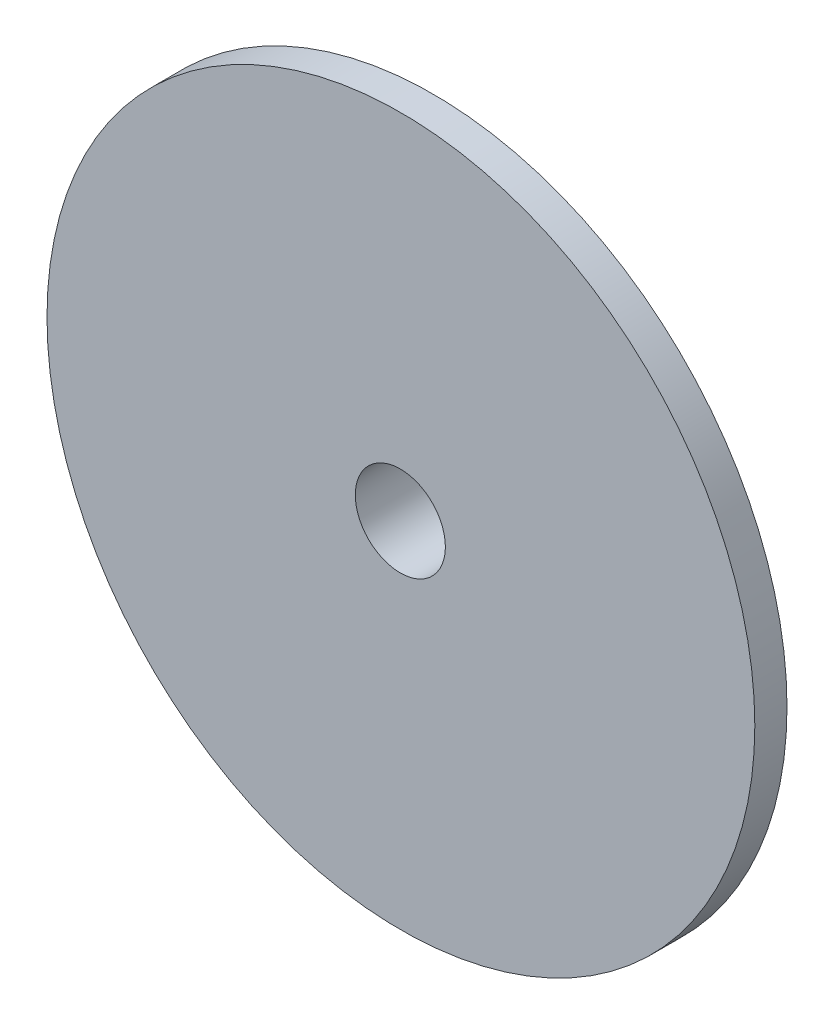
from build123d import *

# Parameters (mm, degrees)
SKETCH1_R             = 4
BOSS_EXTRUDE1_DEPTH   = 10
BOSS_EXTRUDE1_2_DEPTH = 10
SKETCH1_3_R           = 55
BOSS_EXTRUDE2_DEPTH   = 5
SKETCH2_R             = 7
CUT_EXTRUDE1_DEPTH    = 80.277412294


with BuildPart() as part:
    # Sketch1 → Boss-Extrude1 (new body)
    with BuildSketch(Plane.XY):
        with Locations((-46.163581641, 19.207370937)):
            Circle(SKETCH1_R)
    extrude(amount=-BOSS_EXTRUDE1_DEPTH)



with BuildPart() as body_2:
    # Sketch1 → Boss-Extrude1 2 (new body)
    with BuildSketch(Plane.XY):
        with BuildLine():
            ThreePointArc((-28.744125942, -27.906815487), (36.926456917, -15.466500887), (-0.505940955, 39.906800169))
            ThreePointArc((-0.505940955, 39.906800169), (-9.337651898, 3.798280238), (-28.744125942, -27.906815487))
        make_face()
    extrude(amount=-BOSS_EXTRUDE1_2_DEPTH)


with BuildPart() as part_1:
    add(part.part)

    add(body_2.part)  # Boss-Extrude2 merges body 2
    # Sketch1<3> → Boss-Extrude2 (add)
    with BuildSketch(Plane.XY):
        with Locations((0.09, 0)):
            Circle(SKETCH1_3_R)
    extrude(amount=BOSS_EXTRUDE2_DEPTH)

    # Sketch2 → Cut-Extrude1 (cut, through all)
    with BuildSketch(Plane.XY.offset(5)):
        Circle(SKETCH2_R)
    extrude(amount=-CUT_EXTRUDE1_DEPTH, mode=Mode.SUBTRACT)


solid = part_1.part
